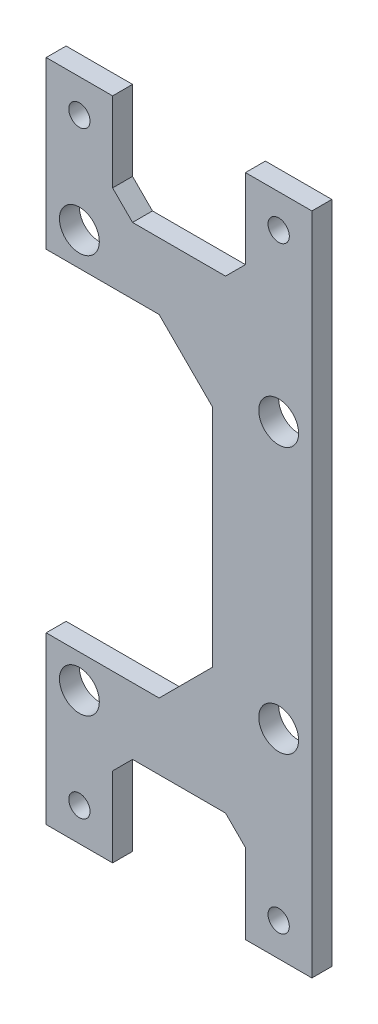
from build123d import *

# Parameters (mm, degrees)
SKETCH_1_W          = 40
SKETCH_1_H          = 100
SKETCH_1_R          = 1.6
SKETCH_1_R_2        = 3
EXTRUDE_1_DEPTH     = 3
SKETCH_2_W          = 20
SKETCH_2_H          = 15
CUT_EXTRUDE_1_DEPTH = 108.745069493
CHAMFER_1_SIZE      = 3
SKETCH_3_W          = 25
SKETCH_3_H          = 50
CUT_EXTRUDE_2_DEPTH = 108.745069493
CHAMFER_2_SIZE      = 8


with BuildPart() as part:
    # ｽｹｯﾁ1 → ﾎﾞｽ - 押し出し1 (new body)
    with BuildSketch(Plane.XY):
        with Locations((20, 50)):
            Rectangle(SKETCH_1_W, SKETCH_1_H)
        with Locations((5, 95)):
            Circle(SKETCH_1_R, mode=Mode.SUBTRACT)
        with Locations((35, 95)):
            Circle(SKETCH_1_R, mode=Mode.SUBTRACT)
        with Locations((5, 80)):
            Circle(SKETCH_1_R_2, mode=Mode.SUBTRACT)
        with Locations((35, 70)):
            Circle(SKETCH_1_R_2, mode=Mode.SUBTRACT)
        with Locations((5, 20)):
            Circle(SKETCH_1_R_2, mode=Mode.SUBTRACT)
        with Locations((35, 30)):
            Circle(SKETCH_1_R_2, mode=Mode.SUBTRACT)
        with Locations((5, 5)):
            Circle(SKETCH_1_R, mode=Mode.SUBTRACT)
        with Locations((35, 5)):
            Circle(SKETCH_1_R, mode=Mode.SUBTRACT)
    extrude(amount=EXTRUDE_1_DEPTH)

    # ｽｹｯﾁ2 → ｶｯﾄ - 押し出し1 (cut, through all)
    with BuildSketch(Plane.XY.offset(3)):
        with Locations((20, 92.5)):
            Rectangle(SKETCH_2_W, SKETCH_2_H)
        with Locations((20, 7.5)):
            Rectangle(SKETCH_2_W, SKETCH_2_H)
    extrude(amount=-CUT_EXTRUDE_1_DEPTH, mode=Mode.SUBTRACT)

    # 面取り1
    chamfer_1_edges = [part.edges().sort_by_distance(p)[0] for p in [
        (10, 85, 1.5),
        (30, 85, 1.5),
        (10, 15, 1.5),
        (30, 15, 1.5),
    ]]
    chamfer(chamfer_1_edges, length=CHAMFER_1_SIZE)

    # ｽｹｯﾁ3 → ｶｯﾄ - 押し出し2 (cut, through all)
    with BuildSketch(Plane(origin=(0, 0, 0), x_dir=(-1, 0, 0), z_dir=(0, 0, -1))):
        with Locations((-12.5, 50)):
            Rectangle(SKETCH_3_W, SKETCH_3_H)
    extrude(amount=-CUT_EXTRUDE_2_DEPTH, mode=Mode.SUBTRACT)

    # 面取り2
    chamfer_2_edges = [part.edges().sort_by_distance(p)[0] for p in [
        (25, 25, 1.5),
        (25, 75, 1.5),
    ]]
    chamfer(chamfer_2_edges, length=CHAMFER_2_SIZE)


solid = part.part
